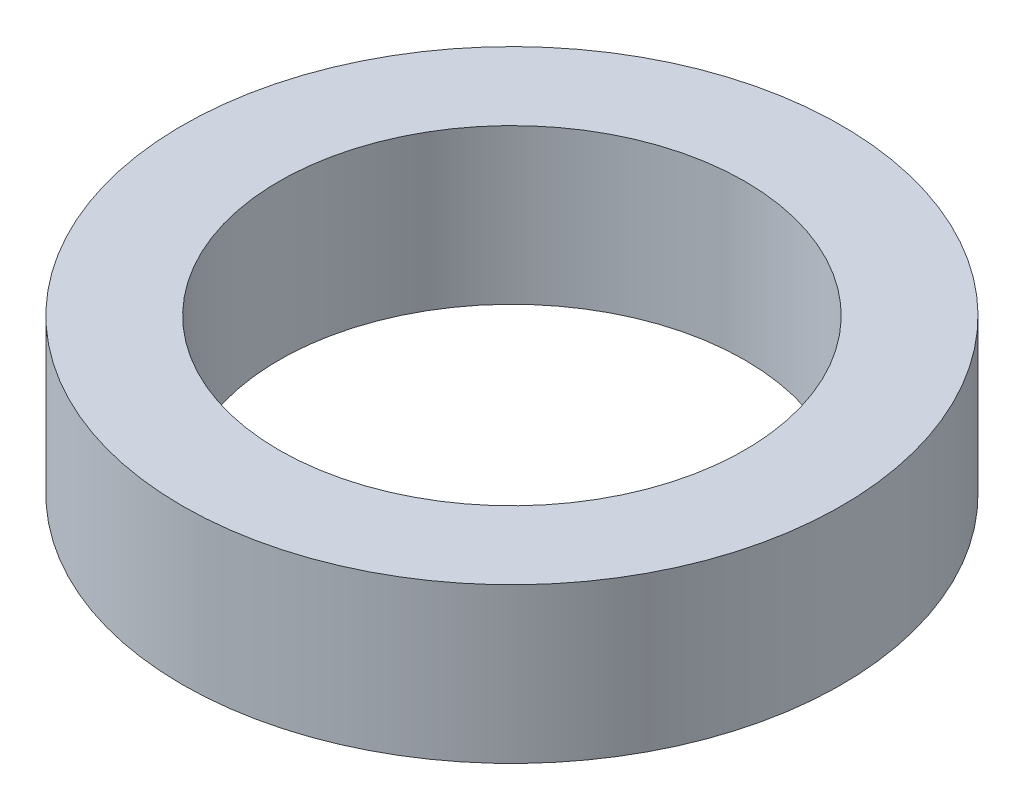
from build123d import *

# Parameters (mm, degrees)
SKETCH2_R           = 108.1786
SKETCH2_R_2         = 76.4286
BOSS_EXTRUDE1_DEPTH = 50.8


with BuildPart() as part:
    # Sketch2 → Boss-Extrude1 (new body)
    with BuildSketch(Plane(origin=(0, 0, 0), x_dir=(1, 0, 0), z_dir=(0, 1, 0))):
        with Locations(Location((0, 0, 0), (0, 0, 270))):
            Circle(SKETCH2_R)
        with Locations(Location((0, 0, 0), (0, 0, 270))):
            Circle(SKETCH2_R_2, mode=Mode.SUBTRACT)
    extrude(amount=BOSS_EXTRUDE1_DEPTH)


solid = part.part
